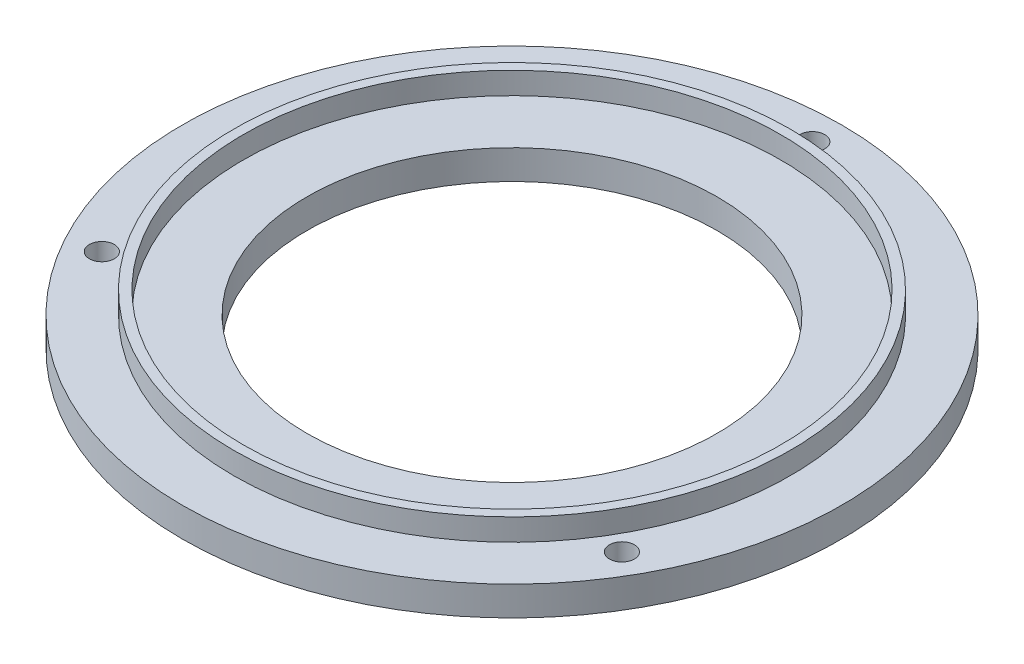
from build123d import *

# Parameters (mm, degrees)
SKETCH1_R                          = 45
SKETCH1_R_2                        = 28
COLLAR_ANNULUS_OD90_ID56_T4_DEPTH  = 4
SKETCH2_R                          = 38
SKETCH2_R_2                        = 36.7
RETAINING_RIM_OD76_ID73_4_H3_DEPTH = 3
MOUNTING_HOLES_3X_3_4_PCD82_D      = 3.4


with BuildPart() as part:
    # Sketch1 → Collar_Annulus_OD90_ID56_T4 (new body)
    with BuildSketch(Plane(origin=(0, 0, 0), x_dir=(1, 0, 0), z_dir=(0, 1, 0))):
        with Locations(Location((0, 0, 0), (0, 0, 270))):
            Circle(SKETCH1_R)
        with Locations(Location((0, 0, 0), (0, 0, 270))):
            Circle(SKETCH1_R_2, mode=Mode.SUBTRACT)
    extrude(amount=COLLAR_ANNULUS_OD90_ID56_T4_DEPTH)

    # Sketch2 → Retaining_Rim_OD76_ID73.4_H3 (add)
    with BuildSketch(Plane(origin=(0, 4, 0), x_dir=(1, 0, 0), z_dir=(0, 1, 0))):
        with Locations(Location((0, 0, 0), (0, 0, 270))):
            Circle(SKETCH2_R)
        with Locations(Location((0, 0, 0), (0, 0, 270))):
            Circle(SKETCH2_R_2, mode=Mode.SUBTRACT)
    extrude(amount=RETAINING_RIM_OD76_ID73_4_H3_DEPTH)

    # Mounting_Holes_3xØ3.4_PCD82 (through all)
    with Locations(Plane(origin=(0, 4, 0), x_dir=(1, 0, 0), z_dir=(0, 1, 0))):
        with Locations((-35.507041555, -20.5), (0, 41), (35.507041555, -20.5)):
            Hole(MOUNTING_HOLES_3X_3_4_PCD82_D / 2)


solid = part.part
